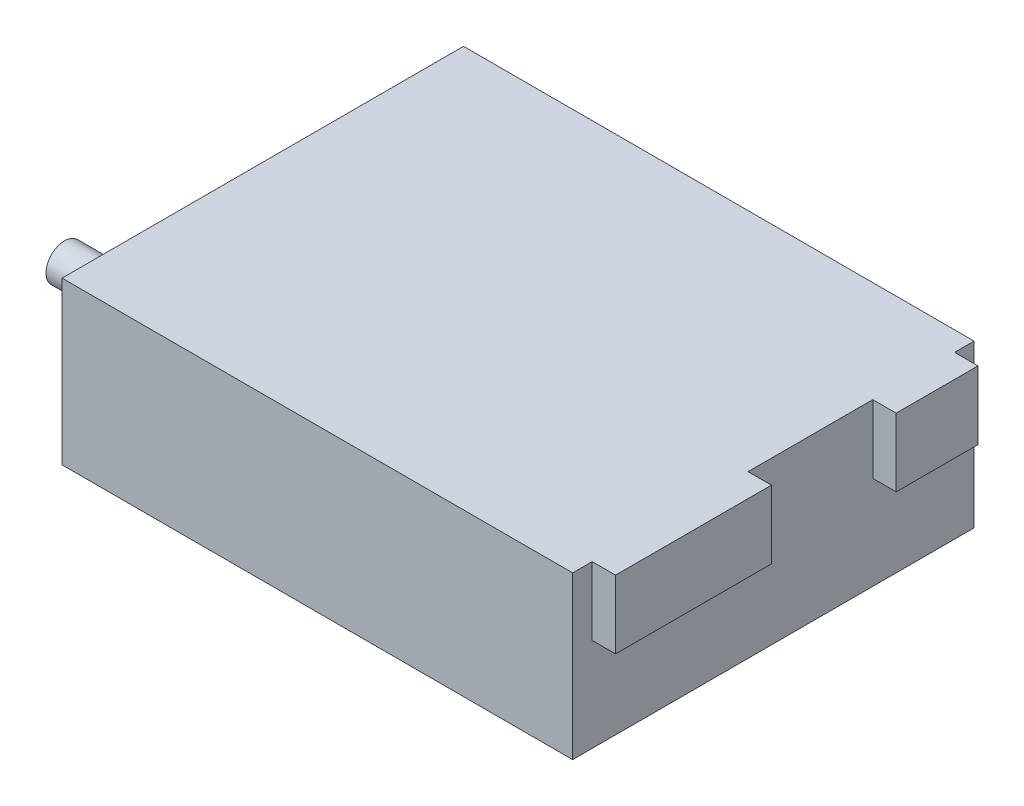
from build123d import *

# Parameters (mm, degrees)
SKETCH1_W           = 26.2
SKETCH1_H           = 20.6
BOSS_EXTRUDE1_DEPTH = 8.3
SKETCH2_W           = 8
SKETCH2_H           = 3.5
SKETCH2_W_2         = 4.2
BOSS_EXTRUDE2_DEPTH = 1.2
SKETCH3_R           = 0.95
BOSS_EXTRUDE3_DEPTH = 5


with BuildPart() as part:
    # Sketch1 → Boss-Extrude1 (new body)
    with BuildSketch(Plane(origin=(0, 0, 0), x_dir=(1, 0, 0), z_dir=(0, 1, 0))):
        Rectangle(SKETCH1_W, SKETCH1_H)
    extrude(amount=BOSS_EXTRUDE1_DEPTH)

    # Sketch2 → Boss-Extrude2 (add)
    with BuildSketch(Plane(origin=(13.1, 0, 0), x_dir=(0, 0, -1), z_dir=(1, 0, 0))):
        with Locations((-5.3, 6.55)):
            Rectangle(SKETCH2_W, SKETCH2_H)
        with Locations((7.2, 6.55)):
            Rectangle(SKETCH2_W_2, SKETCH2_H)
    extrude(amount=BOSS_EXTRUDE2_DEPTH)

    # Sketch3 → Boss-Extrude3 (add)
    with BuildSketch(Plane.ZY.offset(13.1)):
        with Locations(Location((5.174837269, 3.945319614, 0), (0, 0, 180))):
            Circle(SKETCH3_R)
    extrude(amount=BOSS_EXTRUDE3_DEPTH)


solid = part.part
